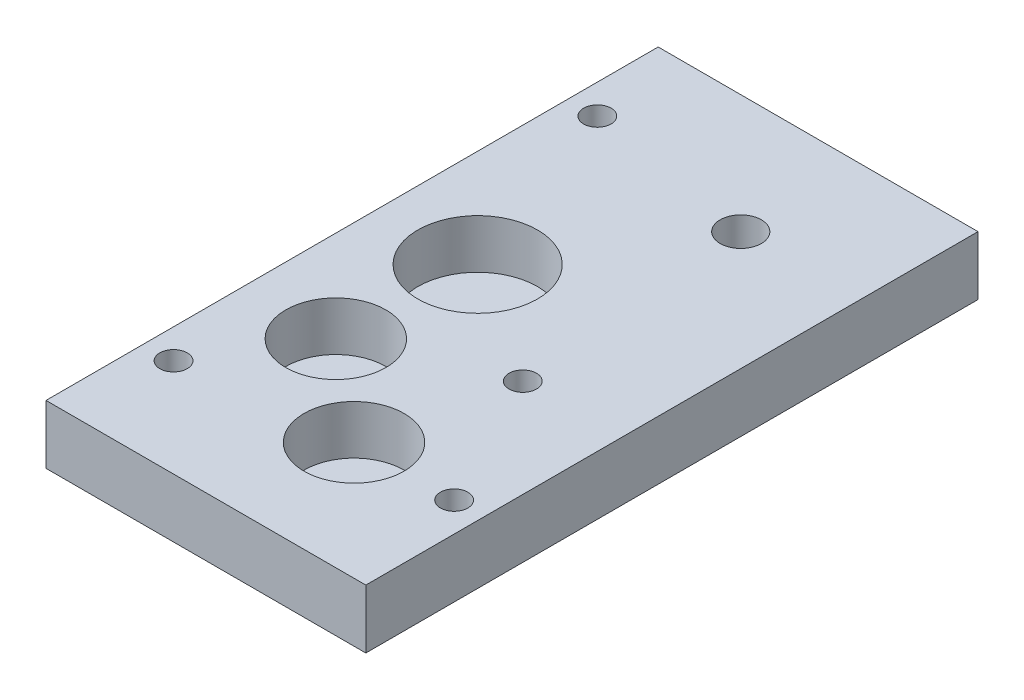
from build123d import *

# Parameters (mm, degrees)
SKETCH_1_W          = 16.3
SKETCH_1_H          = 31.2
EXTRUDE_1_DEPTH     = 3
CUT_EXTRUDE_START   = 3
SKETCH_1_3_R        = 3.05
SKETCH_1_3_R_2      = 2.55
SKETCH_1_3_R_3      = 1.05
CUT_EXTRUDE_1_DEPTH = 2.5
SKETCH_2_R          = 1
CUT_EXTRUDE_2_DEPTH = 1.5
SKETCH_2_3_R        = 0.7
CUT_EXTRUDE_3_DEPTH = 21.632256299


with BuildPart() as part:
    # 草图1 → 凸台-拉伸1 (new body)
    with BuildSketch(Plane(origin=(0, 0, 0), x_dir=(1, 0, 0), z_dir=(0, 1, 0))):
        with Locations((3.15, -1.4)):
            Rectangle(SKETCH_1_W, SKETCH_1_H)
    extrude(amount=EXTRUDE_1_DEPTH)

    # 草图1<3> → 切除-拉伸1 (cut)
    with BuildSketch(Plane(origin=(0, 0, 0), x_dir=(1, 0, 0), z_dir=(0, 1, 0)).offset(CUT_EXTRUDE_START)):
        with Locations(Location((0, 0, 0), (0, 0, 90))):
            Circle(SKETCH_1_3_R)
        with Locations(Location((4.7, -11, 0), (0, 0, 90))):
            Circle(SKETCH_1_3_R_2)
        with Locations(Location((-0.337099263, -6.891760594, 0), (0, 0, 90))):
            Circle(SKETCH_1_3_R_2)
        with Locations(Location((5.25646039, 8.152277238, 0), (0, 0, 90))):
            Circle(SKETCH_1_3_R_3)
    extrude(amount=-CUT_EXTRUDE_1_DEPTH, mode=Mode.SUBTRACT)

    # 草图2 → 切除-拉伸2 (cut)
    with BuildSketch(Plane.XZ):
        with Locations(Location((9.8, 11, 0), (0, 0, 270))):
            Circle(SKETCH_2_R)
        with Locations(Location((-3.5, 12, 0), (0, 0, 270))):
            Circle(SKETCH_2_R)
        with Locations(Location((6.3, 4, 0), (0, 0, 270))):
            Circle(SKETCH_2_R)
        with Locations(Location((-3.5, -9.6, 0), (0, 0, 270))):
            Circle(SKETCH_2_R)
    extrude(amount=-CUT_EXTRUDE_2_DEPTH, mode=Mode.SUBTRACT)

    # 草图2<3> → 切除-拉伸3 (cut, through all)
    with BuildSketch(Plane.XZ):
        with Locations(Location((9.8, 11, 0), (0, 0, 270))):
            Circle(SKETCH_2_3_R)
        with Locations(Location((-3.5, 12, 0), (0, 0, 270))):
            Circle(SKETCH_2_3_R)
        with Locations(Location((6.3, 4, 0), (0, 0, 270))):
            Circle(SKETCH_2_3_R)
        with Locations(Location((-3.5, -9.6, 0), (0, 0, 270))):
            Circle(SKETCH_2_3_R)
    extrude(amount=-CUT_EXTRUDE_3_DEPTH, mode=Mode.SUBTRACT)


solid = part.part
